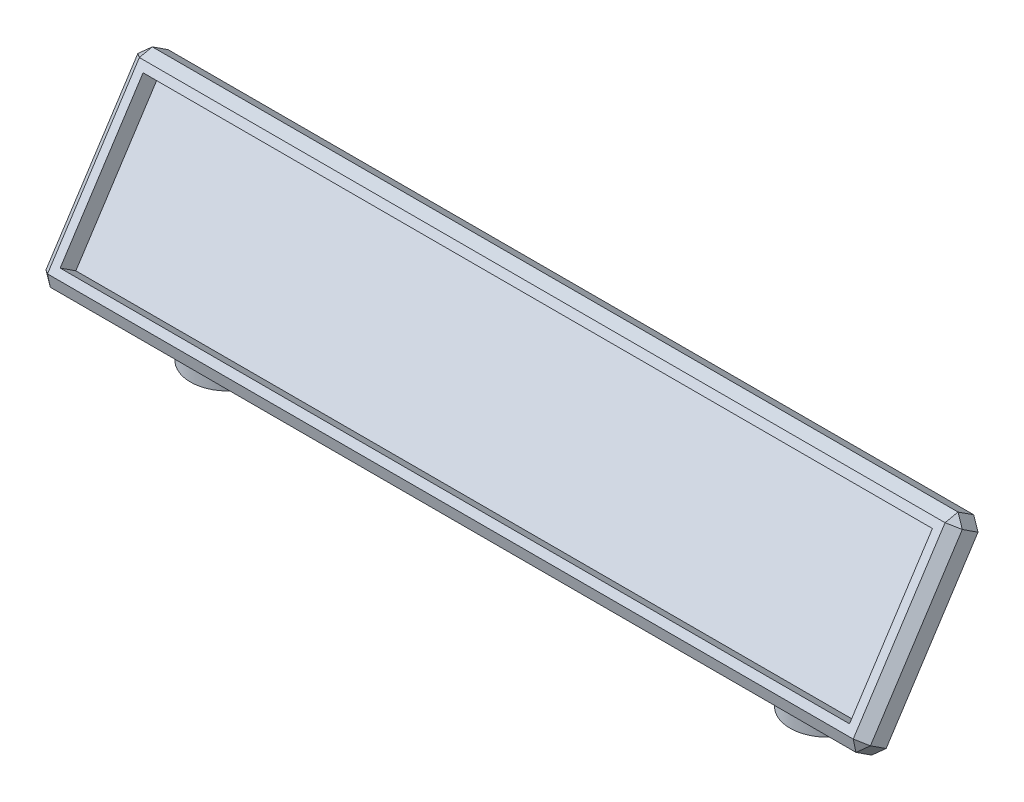
from build123d import *

# Parameters (mm, degrees)
SKETCH2_R             = 6.35
BOSS_EXTRUDE1_DEPTH   = 19.05
BOSS_EXTRUDE1_2_DEPTH = 19.05
SKETCH3_W             = 139.7
SKETCH3_H             = 31.75
BOSS_EXTRUDE2_DEPTH   = 6.35
BOSS_EXTRUDE3_REACH   = 75.737
SKETCH9_W             = 133.75
SKETCH9_H             = 25.8
CUT_EXTRUDE1_DEPTH    = 3.175
CHAMFER2_SIZE         = 1.5875
HOLE1_D               = 5.08
HOLE1_DEPTH           = 10.16
HOLE1_CBORE_D         = 6.35
HOLE1_CBORE_DEPTH     = 0.6858


with BuildPart() as part:
    # Sketch2 → Boss-Extrude1 (new body)
    with BuildSketch(Plane(origin=(0, 0, 0), x_dir=(1, 0, 0), z_dir=(0, 1, 0))):
        with Locations((-50.8, 0)):
            Circle(SKETCH2_R)
    extrude(amount=BOSS_EXTRUDE1_DEPTH)



with BuildPart() as body_2:
    # Sketch2 → Boss-Extrude1 2 (new body)
    with BuildSketch(Plane(origin=(0, 0, 0), x_dir=(1, 0, 0), z_dir=(0, 1, 0))):
        with Locations((50.8, 0)):
            Circle(SKETCH2_R)
    extrude(amount=BOSS_EXTRUDE1_2_DEPTH)


with BuildPart() as part_1:
    add(part.part)

    add(body_2.part)  # Boss-Extrude2 merges body 2
    # Sketch3 → Boss-Extrude2 (add)
    with BuildSketch(Plane(origin=(0, 5.650833475, 8.701520484), x_dir=(-1, 0, 0), z_dir=(0, 0.5446390350150281, 0.8386705679454234))):
        with Locations((0, -15.976674319)):
            Rectangle(SKETCH3_W, SKETCH3_H)
    extrude(amount=BOSS_EXTRUDE2_DEPTH)

    # Sketch8 → Boss-Extrude3 (add, up to next)
    with BuildSketch(Plane(origin=(0, 19.05, 0), x_dir=(1, 0, 0), z_dir=(0, 1, 0)), mode=Mode.PRIVATE) as boss_extrude3_sk1:
        with BuildLine():
            ThreePointArc((57.15, 0), (50.8, 6.35), (44.45, 0))
            Line((44.45, 0), (57.15, 0))
        make_face()
    boss_extrude3_tool1 = extrude(boss_extrude3_sk1.sketch, amount=BOSS_EXTRUDE3_REACH, mode=Mode.PRIVATE) - part_1.part
    # Sketch8 → Boss-Extrude3 (add, up to next)
    with BuildSketch(Plane(origin=(0, 19.05, 0), x_dir=(1, 0, 0), z_dir=(0, 1, 0)), mode=Mode.PRIVATE) as boss_extrude3_sk2:
        with BuildLine():
            ThreePointArc((-44.45, 0), (-50.8, 6.35), (-57.15, 0))
            Line((-57.15, 0), (-44.45, 0))
        make_face()
    boss_extrude3_tool2 = extrude(boss_extrude3_sk2.sketch, amount=BOSS_EXTRUDE3_REACH, mode=Mode.PRIVATE) - part_1.part
    add(boss_extrude3_tool1.solids().sort_by_distance((50.8, 19.05, -2.695024))[0])
    add(boss_extrude3_tool2.solids().sort_by_distance((-50.8, 19.05, -2.695024))[0])

    # Sketch9 → Cut-Extrude1 (cut)
    with BuildSketch(Plane(origin=(0, 9.109291347, 14.02707859), x_dir=(1, 0, 0), z_dir=(0, 0.5446390350150282, 0.8386705679454234))):
        with Locations((0, 15.976674319)):
            Rectangle(SKETCH9_W, SKETCH9_H)
    extrude(amount=-CUT_EXTRUDE1_DEPTH, mode=Mode.SUBTRACT)

    # Chamfer2
    chamfer2_edges = [part_1.edges().sort_by_distance(p)[0] for p in [
        (-69.85, 19.05, 0),
        (0, 32.363895266, -8.646144681),
        (69.85, 19.05, 0),
        (0, 5.736104734, 8.646144681),
        (0, 9.194562606, 13.971702787),
        (-69.85, 7.46533367, 11.308923734),
        (-69.85, 22.508457872, 5.325558106),
        (69.85, 7.46533367, 11.308923734),
        (69.85, 22.508457872, 5.325558106),
        (69.85, 34.093124202, -5.983365628),
        (0, 35.822353138, -3.320586574),
        (-69.85, 34.093124202, -5.983365628),
    ]]
    chamfer(chamfer2_edges, length=CHAMFER2_SIZE)

    # Hole1
    with Locations(Plane(origin=(-50.8, 0, 0), x_dir=(0, 0, -1), z_dir=(0, -1, 0))):
        with Locations((0, 0), (0, 101.6)):
            CounterBoreHole(HOLE1_D / 2, HOLE1_CBORE_D / 2, HOLE1_CBORE_DEPTH, depth=HOLE1_DEPTH)


solid = part_1.part
